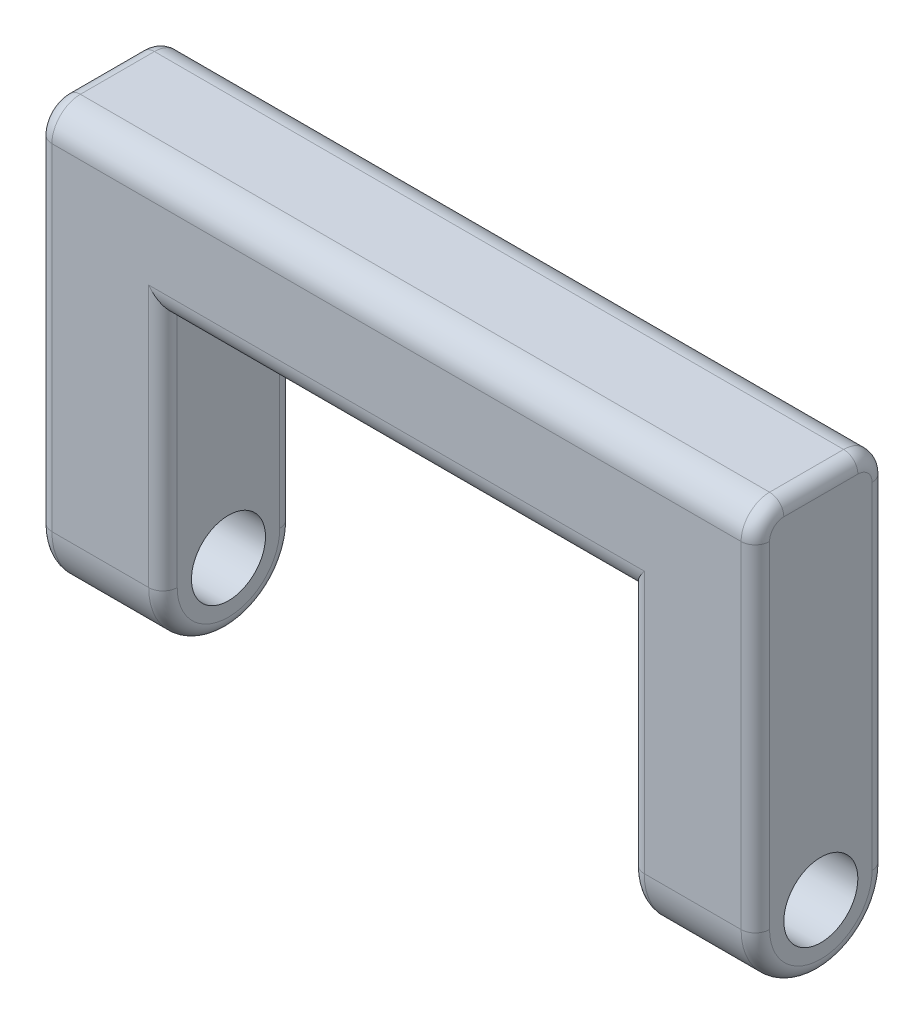
from build123d import *

# Parameters (mm, degrees)
SKETCH1_R            = 6.5
BOSS_EXTRUDE1_DEPTH  = 22
BOSS_EXTRUDE3_START  = 82
BOSS_EXTRUDE3_DEPTH  = 82
FILLET3_R            = 2.5
FILLET3_OF_MIRROR1_R = 2.5


with BuildPart() as part:
    # Sketch1 → Boss-Extrude1 (new body)
    with BuildSketch(Plane(origin=(0, 0, 0), x_dir=(0, 0, -1), z_dir=(1, 0, 0))):
        with BuildLine():
            ThreePointArc((-11.500000000000002, 5.047646664e-08), (-2.523822962e-08, -11.500000000000002), (11.500000000000002, -2.82e-15))
            Line((11.500000000000002, 0), (11.499999999999998, 59.00000000000001))
            ThreePointArc((11.499999999999998, 59.00000000000001), (10.035533905932727, 62.53553390593273), (6.5, 63.999999999999986))
            Line((6.5, 63.999999999999986), (-6.5, 64))
            ThreePointArc((-6.5, 64), (-10.035533905932738, 62.53553390593274), (-11.5, 59))
            Line((-11.5, 59), (-11.5, 5.047646567e-08))
        make_face()
        Circle(SKETCH1_R, mode=Mode.SUBTRACT)
    boss_extrude1 = extrude(amount=-BOSS_EXTRUDE1_DEPTH)

    # Sketch1<4> → Boss-Extrude3 (add)
    with BuildSketch(Plane(origin=(0, 0, 0), x_dir=(0, 0, -1), z_dir=(1, 0, 0)).offset(BOSS_EXTRUDE3_START)):
        with BuildLine():
            Line((-11.5, 58.99999999999999), (-11.5, 46))
            ThreePointArc((-11.499999999999996, 46), (-10.035533905932734, 42.46446609406726), (-6.499999999999998, 41))
            Line((-6.499999999999997, 41), (6.500000000000003, 41))
            ThreePointArc((6.500000000000003, 41), (10.035533905932741, 42.46446609406726), (11.500000000000004, 46))
            Line((11.499999999999998, 46), (11.499999999999998, 59.00000000000001))
            ThreePointArc((11.499999999999998, 59.00000000000001), (10.035533905932727, 62.53553390593273), (6.5, 63.999999999999986))
            Line((6.5, 63.999999999999986), (-6.5, 64))
            ThreePointArc((-6.5, 64), (-10.035533905932738, 62.53553390593274), (-11.5, 59))
        make_face()
    extrude(amount=-BOSS_EXTRUDE3_DEPTH)

    # Fillet3
    fillet3_edges = [part.edges().sort_by_distance(p)[0] for p in [
        (-22, -11.500000000000002, 2.523823384e-08),
        (-22, 29.500000025238233, 11.5),
        (-22, 62.53553390593274, 10.035533905932738),
        (-22, 63.99999999999999, 0),
        (-22, 62.53553390593273, -10.035533905932729),
        (-22, 29.500000000000004, -11.5),
        (0, 23, -11.5),
        (0, -11.500000000000002, 2.523823384e-08),
        (0, 23.000000025238236, 11.5),
    ]]
    fillet(fillet3_edges, radius=FILLET3_R)

    # Mirror1: Boss-Extrude1 across plane
    add(boss_extrude1.mirror(Plane(origin=(41.00000000000001, 0, 0), x_dir=(0, 0, 1), z_dir=(1, 0, 0))))

    # Fillet3 of Mirror1
    fillet3_of_mirror1_edges = [part.edges().sort_by_distance(p)[0] for p in [
        (104.00000000000001, -11.500000000000002, 2.523823384e-08),
        (104.00000000000001, 29.500000025238233, 11.5),
        (104.00000000000001, 62.53553390593274, 10.035533905932738),
        (104.00000000000001, 63.99999999999999, 0),
        (104.00000000000001, 62.53553390593273, -10.035533905932729),
        (104.00000000000001, 29.500000000000004, -11.5),
        (82.00000000000001, 23, -11.5),
        (82.00000000000001, -11.500000000000002, 2.523823384e-08),
        (82.00000000000001, 23.000000025238236, 11.5),
    ]]
    fillet(fillet3_of_mirror1_edges, radius=FILLET3_OF_MIRROR1_R)


solid = part.part
